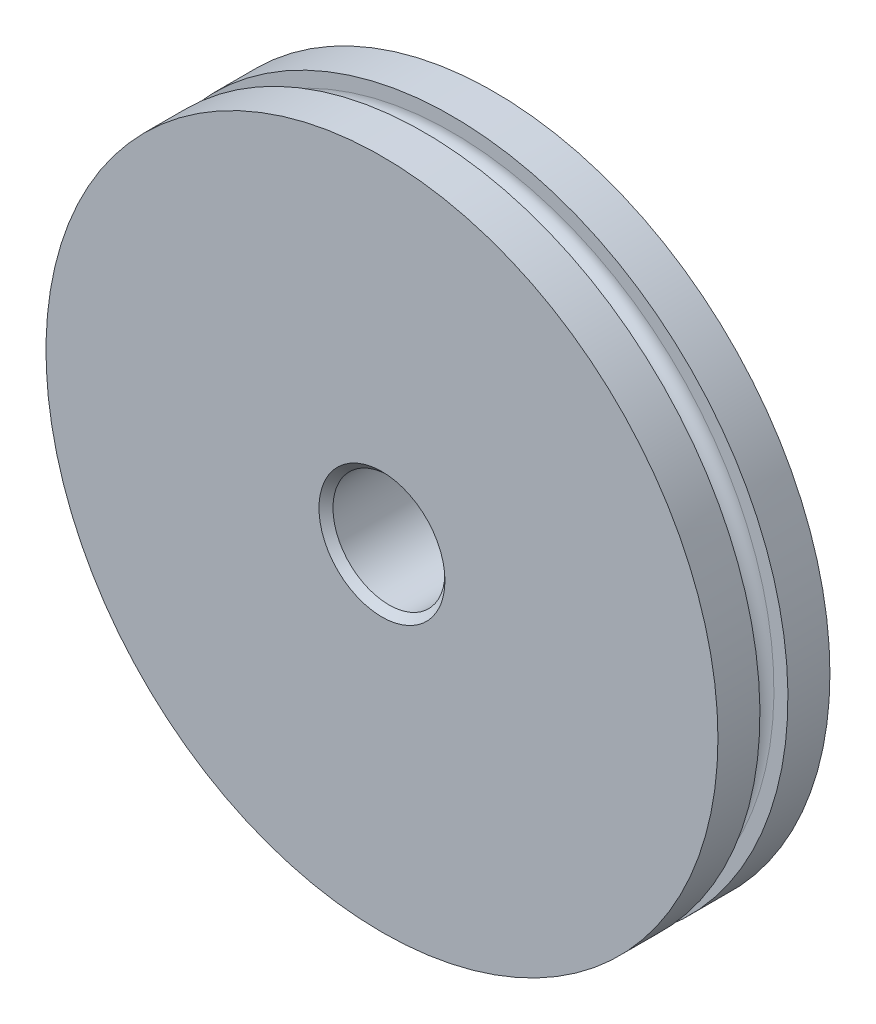
from build123d import *

# Parameters (mm, degrees)
SKETCH1_R      = 38.1
SKETCH1_R_2    = 6.35
EXTRUDE1_DEPTH = 6.35
CHAMFER1_SIZE  = 0.79375


with BuildPart() as part:
    # Sketch1 → Extrude1 (new, symmetric)
    with BuildSketch(Plane.XY):
        Circle(SKETCH1_R)
        Circle(SKETCH1_R_2, mode=Mode.SUBTRACT)
    extrude(amount=EXTRUDE1_DEPTH, both=True)

    # Chamfer1
    chamfer1_edges = [part.edges().sort_by_distance(p)[0] for p in [
        (-6.35, 0, -6.35),
        (-6.35, 0, 6.35),
    ]]
    chamfer(chamfer1_edges, length=CHAMFER1_SIZE)

    # Sketch2 → Cut-Revolve1 (revolve, cut)
    with BuildSketch(Plane(origin=(0, 0, 0), x_dir=(0, 0, -1), z_dir=(1, 0, 0)), mode=Mode.PRIVATE) as cut_revolve1_sk:
        with BuildLine():
            Line((-1.5875, 36.5125), (-1.5875, 38.1))
            Line((-1.5875, 38.1), (1.5875, 38.1))
            Line((1.5875, 38.1), (1.5875, 36.5125))
            ThreePointArc((1.5875, 36.5125), (0, 34.925), (-1.5875, 36.5125))
        make_face()
    revolve(cut_revolve1_sk.sketch.rotate(Axis((0, 0, 6.35), (0, 0, -1)), 180), axis=Axis((0, 0, 6.35), (0, 0, -1)), mode=Mode.SUBTRACT)


solid = part.part
